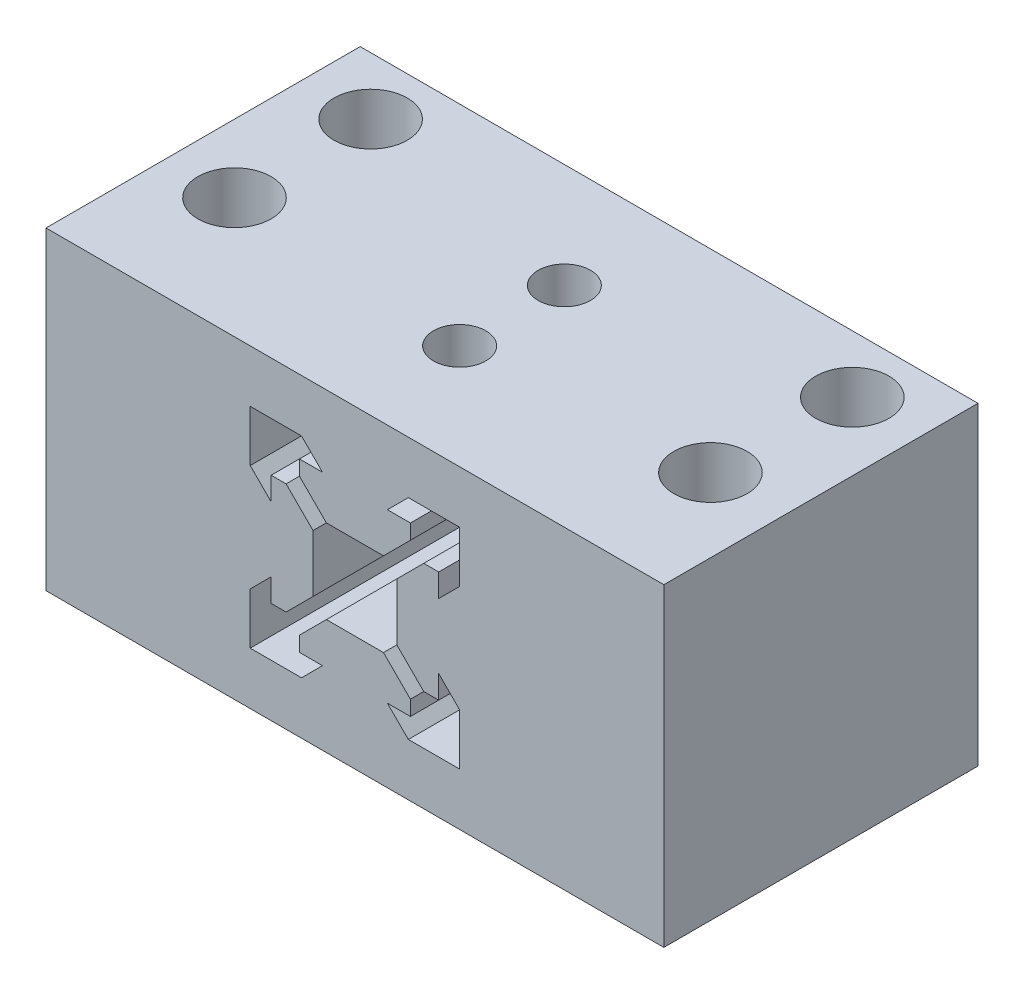
from build123d import *

# Parameters (mm, degrees)
SKETCH1_W           = 59
SKETCH1_H           = 30
BOSS_EXTRUDE1_DEPTH = 30
SKETCH2_R           = 2.5
SKETCH2_R_2         = 3.5
CUT_EXTRUDE1_DEPTH  = 52.674461778


with BuildPart() as part:
    # Sketch1 → Boss-Extrude1 (new body)
    with BuildSketch(Plane.XY):
        Rectangle(SKETCH1_W, SKETCH1_H)
        Polygon((4, 2.727207794), (6.572792206, 5.3), (8, 5.3), (8, 3.1), (10, 5.1), (10, 10), (5.1, 10), (3.1, 8), (5.3, 8), (5.3, 6.572792206), (2.727207794, 4), (-2.727207794, 4), (-5.3, 6.572792206), (-5.3, 8), (-3.1, 8), (-5.1, 10), (-10, 10), (-10, 5.1), (-8, 3.1), (-8, 5.3), (-6.572792206, 5.3), (-4, 2.727207794), (-4, -2.727207794), (-6.572792206, -5.3), (-8, -5.3), (-8, -3.1), (-10, -5.1), (-10, -10), (-5.1, -10), (-3.1, -8), (-5.3, -8), (-5.3, -6.572792206), (-2.727207794, -4), (2.727207794, -4), (5.3, -6.572792206), (5.3, -8), (3.1, -8), (5.1, -10), (10, -10), (10, -5.1), (8, -3.1), (8, -5.3), (6.572792206, -5.3), (4, -2.727207794), align=None, mode=Mode.SUBTRACT)
    extrude(amount=-BOSS_EXTRUDE1_DEPTH)

    # Sketch2 → Cut-Extrude1 (cut, through all)
    with BuildSketch(Plane(origin=(0, 15, 0), x_dir=(1, 0, 0), z_dir=(0, 1, 0))):
        with Locations(Location((0, 10, 0), (0, 0, 270))):
            Circle(SKETCH2_R)
        with Locations(Location((0, 20, 0), (0, 0, 270))):
            Circle(SKETCH2_R)
        with Locations(Location((-23, 24.5, 0), (0, 0, 270))):
            Circle(SKETCH2_R_2)
        with Locations(Location((23, 24.5, 0), (0, 0, 270))):
            Circle(SKETCH2_R_2)
        with Locations(Location((22.450748844, 11.5, 0), (0, 0, 270))):
            Circle(SKETCH2_R_2)
        with Locations(Location((-23, 11.5, 0), (0, 0, 270))):
            Circle(SKETCH2_R_2)
    extrude(amount=-CUT_EXTRUDE1_DEPTH, mode=Mode.SUBTRACT)


solid = part.part
